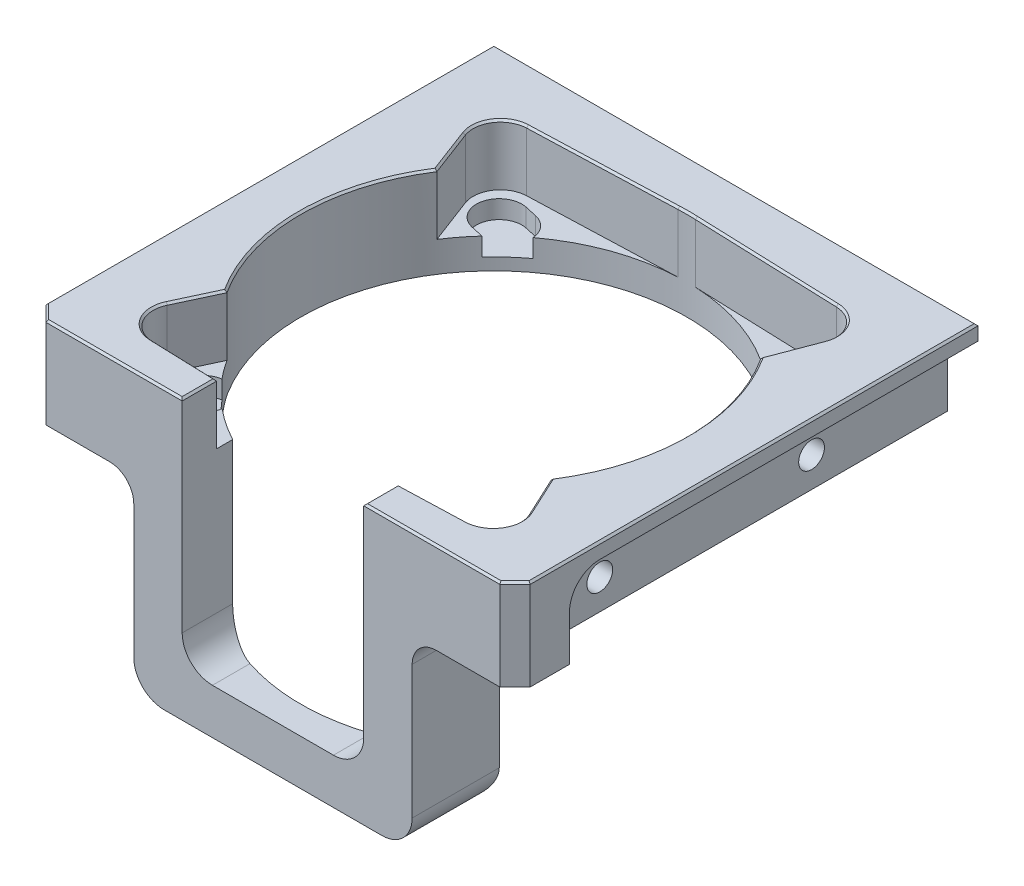
from build123d import *

# Parameters (mm, degrees)
SKETCH1_W                            = 101.6
SKETCH1_H                            = 97.155
BOSS_EXTRUDE1_DEPTH                  = 58.42
SKETCH2_W                            = 21.59
SKETCH2_H                            = 39.37
CUT_EXTRUDE1_DEPTH                   = 125.22813862
SKETCH3_R                            = 40.513
CUT_EXTRUDE2_DEPTH                   = 92.396443619
CUT_EXTRUDE3_START                   = -39.37
CUT_EXTRUDE3_DEPTH                   = 39.37
CUT_EXTRUDE4_REACH                   = 126.228
CUT_EXTRUDE4_END_RADIUS              = 40.513
SKETCH5_W                            = 38.1
SKETCH5_H                            = 48.895
FILLET1_R                            = 6.35
FILLET2_R                            = 5.08
CHAMFER1_SIZE                        = 3.175
CUT_EXTRUDE5_DEPTH                   = 6.35
TAP_DRILL_FOR_1_4_28_TAP1_AT_2_COUNT = 2
TAP_DRILL_FOR_1_4_28_TAP1_AT_2_PITCH = 44.45
TAP_DRILL_FOR_1_4_28_TAP2_D          = 5.4102
TAP_DRILL_FOR_1_4_28_TAP2_DEPTH      = 9.804611939
TAP_DRILL_FOR_1_4_28_TAP2_TIP        = 1.625388061
SKETCH12_R                           = 5.715
CUT_EXTRUDE6_DEPTH                   = 12.7
SKETCH13_R                           = 40.513
CUT_EXTRUDE7_DEPTH                   = 3.81
CHAMFER2_SIZE                        = 0.4


with BuildPart() as part:
    # Sketch1 → Boss-Extrude1 (new body)
    with BuildSketch(Plane(origin=(0, 0, 0), x_dir=(1, 0, 0), z_dir=(0, 1, 0))):
        Rectangle(SKETCH1_W, SKETCH1_H)
    extrude(amount=BOSS_EXTRUDE1_DEPTH)

    # Sketch2 → Cut-Extrude1 (cut, through all)
    with BuildSketch(Plane.XY.offset(48.5775)):
        with Locations((-40.005, 19.685)):
            Rectangle(SKETCH2_W, SKETCH2_H)
        with Locations((40.005, 19.685)):
            Rectangle(SKETCH2_W, SKETCH2_H)
    extrude(amount=-CUT_EXTRUDE1_DEPTH, mode=Mode.SUBTRACT)

    # Sketch3 → Cut-Extrude2 (cut, through all)
    with BuildSketch(Plane(origin=(0, 58.42, 0), x_dir=(1, 0, 0), z_dir=(0, 1, 0))):
        with Locations(Location((0, -2.2225, 0), (0, 0, 270))):
            Circle(SKETCH3_R)
    extrude(amount=-CUT_EXTRUDE2_DEPTH, mode=Mode.SUBTRACT)

    # Sketch4 → Cut-Extrude3 (cut)
    with BuildSketch(Plane.XZ.offset(CUT_EXTRUDE3_START)):
        with BuildLine():
            Line((-29.21, -25.850246018), (-29.21, -48.5775))
            Line((-29.21, -48.5775), (29.21, -48.5775))
            Line((29.21, -48.5775), (29.21, -25.850246018))
            ThreePointArc((29.21, -25.850246018), (0, -38.2905), (-29.21, -25.850246018))
        make_face()
    extrude(amount=CUT_EXTRUDE3_DEPTH, mode=Mode.SUBTRACT)

    # Cut-Extrude4: up to this cylinder (the profile starts outside it)
    cut_extrude4_end = Plane(origin=(0, 33.9725, 2.2225), z_dir=(0, 1, 0)) * Cylinder(CUT_EXTRUDE4_END_RADIUS, 334.482, mode=Mode.PRIVATE)
    # Sketch5 → Cut-Extrude4 (cut, up to the surface)
    with BuildSketch(Plane.XY.offset(48.5775), mode=Mode.PRIVATE) as cut_extrude4_sk1:
        with Locations((0, 33.9725)):
            Rectangle(SKETCH5_W, SKETCH5_H)
    cut_extrude4_tool1 = extrude(cut_extrude4_sk1.sketch, amount=-CUT_EXTRUDE4_REACH, mode=Mode.PRIVATE) - cut_extrude4_end
    add(cut_extrude4_tool1.solids().sort_by_distance((0, 33.9725, 48.5775))[0], mode=Mode.SUBTRACT)

    # Fillet1
    fillet1_edges = [part.edges().sort_by_distance(p)[0] for p in [
        (-29.21, 0, 39.436373009),
        (29.21, 0, 39.436373009),
        (-19.05, 9.525, 43.277364662),
        (19.05, 9.525, 43.277364662),
    ]]
    fillet(fillet1_edges, radius=FILLET1_R)

    # Fillet2
    fillet2_edges = [part.edges().sort_by_distance(p)[0] for p in [
        (-29.21, 39.37, 39.436373009),
        (29.21, 39.37, 39.436373009),
    ]]
    fillet(fillet2_edges, radius=FILLET2_R)

    # Chamfer1
    chamfer1_edges = [part.edges().sort_by_distance(p)[0] for p in [
        (50.8, 48.895, 48.5775),
        (-50.8, 48.895, 48.5775),
    ]]
    chamfer(chamfer1_edges, length=CHAMFER1_SIZE)

    # Sketch6 → Cut-Extrude5 (cut)
    with BuildSketch(Plane.ZY.offset(50.8)):
        with BuildLine():
            Line((-48.5775, 55.245), (30.7975, 55.245))
            ThreePointArc((30.7975, 55.245), (35.287628061, 53.385128061), (37.1475, 48.895))
            Line((37.1475, 48.895), (37.1475, 39.37))
            Line((37.1475, 39.37), (-48.5775, 39.37))
            Line((-48.5775, 39.37), (-48.5775, 55.245))
        make_face()
    cut_extrude5 = extrude(amount=-CUT_EXTRUDE5_DEPTH, mode=Mode.SUBTRACT)

    # Sketch8 → Tap Drill for 1/4-28 Tap1 (revolve, cut)
    with BuildSketch(Plane(origin=(-44.45, 45.72, -20.0025), x_dir=(0, 0, 1), z_dir=(0, 1, 0))):
        Polygon((0, 0), (0, 8.737388061), (2.7051, 7.112), (2.7051, 0), align=None)
    tap_drill_for_1_4_28_tap1 = revolve(axis=Axis((-50.8, 45.72, -20.0025), (1, 0, 0)), mode=Mode.SUBTRACT)

    # Tap Drill for 1/4-28 Tap1 at 2: Tap Drill for 1/4-28 Tap1 ×2
    with Locations(*[(0, 0, i * TAP_DRILL_FOR_1_4_28_TAP1_AT_2_PITCH) for i in range(1, TAP_DRILL_FOR_1_4_28_TAP1_AT_2_COUNT)]):
        add(tap_drill_for_1_4_28_tap1, mode=Mode.SUBTRACT)

    # Tap Drill for 1/4-28 Tap2
    with Locations(Plane(origin=(38.1, 48.895, -48.5775), x_dir=(-1, 0, 0), z_dir=(0, 0, -1))):
        with Locations((0, 0), (76.2, 0)):
            Hole(TAP_DRILL_FOR_1_4_28_TAP2_D / 2, depth=TAP_DRILL_FOR_1_4_28_TAP2_DEPTH)
            with Locations((0, 0, -(TAP_DRILL_FOR_1_4_28_TAP2_DEPTH + TAP_DRILL_FOR_1_4_28_TAP2_TIP / 2))):  # 118° drill point
                Cone(0, TAP_DRILL_FOR_1_4_28_TAP2_D / 2, TAP_DRILL_FOR_1_4_28_TAP2_TIP, mode=Mode.SUBTRACT)

    # Sketch12 → Cut-Extrude6 (cut)
    with BuildSketch(Plane(origin=(0, 58.42, 0), x_dir=(1, 0, 0), z_dir=(0, 1, 0))):
        with Locations((-32.2961, 31.4452)):
            Circle(SKETCH12_R)
        with BuildLine():
            ThreePointArc((-33.992836913, 19.818148984), (-20.14878741, 32.924755012), (-1.84310515, 38.248553018))
            Line((-1.84310515, 38.248553018), (-32.499537967, 37.156577942))
            ThreePointArc((-32.499537967, 37.156577942), (-28.327562674, 35.55761249), (-26.5811, 31.4452))
            ThreePointArc((-26.5811, 31.4452), (-31.264433085, 25.824089044), (-37.638628741, 29.41576371))
            Line((-37.638628741, 29.41576371), (-33.992836913, 19.818148984))
        make_face()
        with BuildLine():
            Line((32.499537967, 37.156577942), (1.84310515, 38.248553018))
            ThreePointArc((1.84310515, 38.248553018), (20.14878741, 32.924755012), (33.992836913, 19.818148984))
            Line((33.992836913, 19.818148984), (37.638628741, 29.41576371))
            ThreePointArc((37.638628741, 29.41576371), (27.534851432, 28.284229093), (32.499537967, 37.156577942))
        make_face()
        with Locations((32.2961, 31.4452)):
            Circle(SKETCH12_R)
        with Locations((32.84347, -35.17392)):
            Circle(SKETCH12_R)
        with BuildLine():
            Line((38.023019003, -32.758656634), (34.032742491, -24.20148104))
            ThreePointArc((34.032742491, -24.20148104), (27.420561588, -32.045577829), (19.05, -37.977229324))
            Line((19.05, -37.977229324), (19.05, -41.349640271))
            Line((19.05, -41.349640271), (33.032951844, -40.885777984))
            ThreePointArc((33.032951844, -40.885777984), (27.973239162, -32.183589486), (38.023019003, -32.758656634))
        make_face()
        with BuildLine():
            ThreePointArc((-19.05, -37.977229324), (-27.420561588, -32.045577829), (-34.032742491, -24.20148104))
            Line((-34.032742491, -24.20148104), (-38.023019003, -32.758656634))
            ThreePointArc((-38.023019003, -32.758656634), (-31.606517606, -29.594388319), (-27.12847, -35.17392))
            ThreePointArc((-27.12847, -35.17392), (-28.869911377, -39.281480939), (-33.032951844, -40.885777984))
            Line((-33.032951844, -40.885777984), (-19.05, -41.349640271))
            Line((-19.05, -41.349640271), (-19.05, -37.977229324))
        make_face()
        with Locations((-32.84347, -35.17392)):
            Circle(SKETCH12_R)
    extrude(amount=-CUT_EXTRUDE6_DEPTH, mode=Mode.SUBTRACT)

    # Sketch13 → Cut-Extrude7 (cut)
    with BuildSketch(Plane(origin=(0, 45.72, 0), x_dir=(1, 0, 0), z_dir=(0, 1, 0))):
        with BuildLine():
            Line((-27.928285617, 34.477511324), (-30.468285617, 35.038851324))
            ThreePointArc((-30.468285617, 35.038851324), (-36.146291324, 31.416274383), (-32.523714383, 25.738268676))
            Line((-32.523714383, 25.738268676), (-29.983714383, 25.176928676))
            ThreePointArc((-29.983714383, 25.176928676), (-29.924483296, 25.164233151), (-29.865095524, 25.152292024))
            ThreePointArc((-29.865095524, 25.152292024), (-27.159369973, 27.838634238), (-24.213087874, 30.258718336))
            ThreePointArc((-24.213087874, 30.258718336), (-25.381844695, 32.974730144), (-27.928285617, 34.477511324))
        make_face()
        with Locations(Location((0, -2.2225, 0), (0, 0, 288.269054449))):
            Circle(SKETCH13_R)
        with BuildLine():
            ThreePointArc((-27.62071326, -36.63561929), (-26.67134071, -29.96767326), (-33.33928674, -29.01830071))
            Line((-33.33928674, -29.01830071), (-35.07156674, -30.31878071))
            ThreePointArc((-35.07156674, -30.31878071), (-36.02093929, -36.98672674), (-29.35299326, -37.93609929))
            Line((-29.35299326, -37.93609929), (-27.62071326, -36.63561929))
        make_face()
    cut_extrude7 = extrude(amount=-CUT_EXTRUDE7_DEPTH, mode=Mode.SUBTRACT)

    # Mirror1: Cut-Extrude5, Tap Drill for 1/4-28 Tap1, Cut-Extrude7 across plane
    add(cut_extrude5.mirror(Plane(origin=(0, 0, 0), x_dir=(0, 0, 1), z_dir=(1, 0, 0))), mode=Mode.SUBTRACT)
    add(tap_drill_for_1_4_28_tap1.mirror(Plane(origin=(0, 0, 0), x_dir=(0, 0, 1), z_dir=(1, 0, 0))), mode=Mode.SUBTRACT)
    add(cut_extrude7.mirror(Plane(origin=(0, 0, 0), x_dir=(0, 0, 1), z_dir=(1, 0, 0))), mode=Mode.SUBTRACT)

    # Mirror1 copy 1 sketch → Mirror1 copy 1 (revolve, cut)
    with BuildSketch(Plane(origin=(44.45, 45.72, 24.4475), x_dir=(0, 0, 1), z_dir=(0, 1, 0))):
        Polygon((0, 0), (0, -8.737388061), (2.7051, -7.112), (2.7051, 0), align=None)
    revolve(axis=Axis((50.8, 45.72, 24.4475), (1, 0, 0)), mode=Mode.SUBTRACT)

    # Chamfer2
    chamfer2_edges = [part.edges().sort_by_distance(p)[0] for p in [
        (50.8, 58.42, -1.5875),
        (-33.3375, 58.42, 48.5775),
        (-49.2125, 58.42, 46.99),
        (49.2125, 58.42, 46.99),
        (0, 58.42, -48.5775),
        (19.05, 58.42, 44.963570135),
        (-19.05, 58.42, 44.963570135),
        (40.512983353, 58.42, 2.185773339),
        (0, 58.42, -38.2905),
        (-40.512983353, 58.42, 2.185773339),
        (-36.027880747, 58.42, 28.480068837),
        (-37.713700838, 58.42, 38.164250514),
        (-26.041475922, 58.42, 41.117709128),
        (37.713700838, 58.42, 38.164250514),
        (36.027880747, 58.42, 28.480068837),
        (26.041475922, 58.42, 41.117709128),
        (17.171321559, 58.42, -37.70256548),
        (35.815732827, 58.42, -24.616956347),
        (37.057348568, 58.42, -34.606170907),
        (-35.815732827, 58.42, -24.616956347),
        (-37.057348568, 58.42, -34.606170907),
        (-17.171321559, 58.42, -37.70256548),
        (-50.8, 58.42, -1.5875),
        (33.3375, 58.42, 48.5775),
    ]]
    chamfer(chamfer2_edges, length=CHAMFER2_SIZE)


solid = part.part
